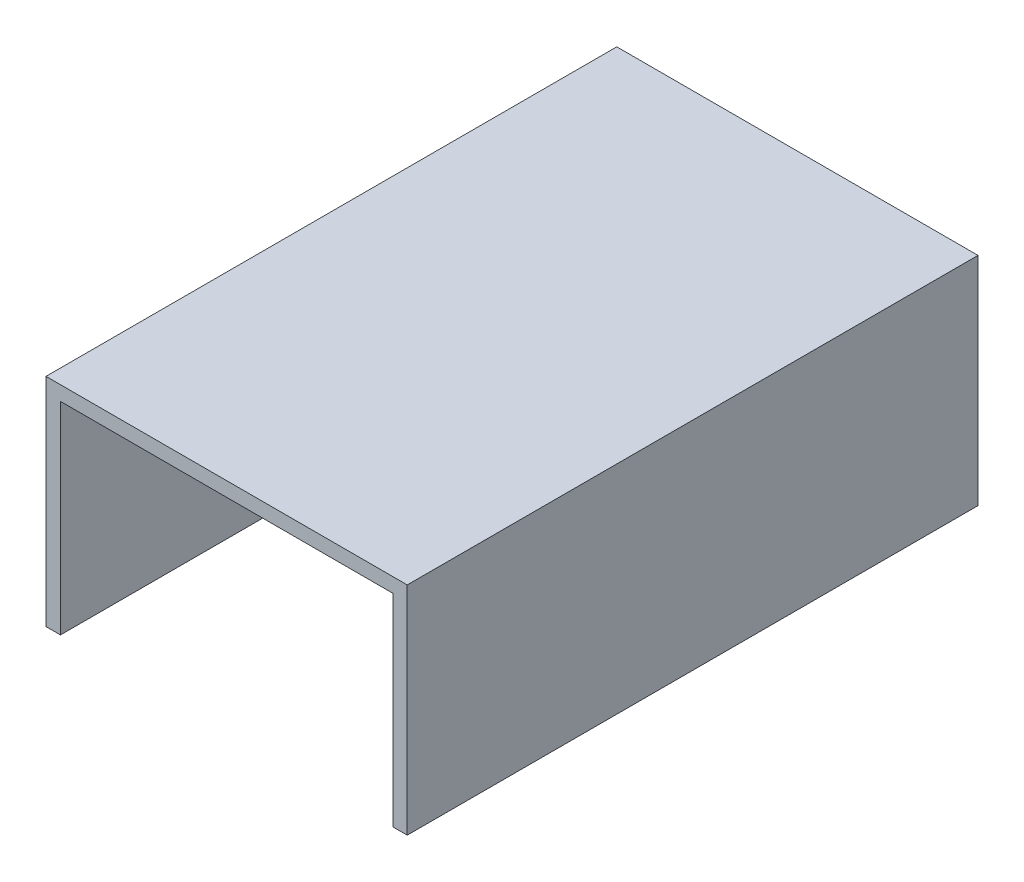
from build123d import *

# Parameters (mm, degrees)
EXTRUDE_THIN1_DEPTH = 79


with BuildPart() as part:
    # Sketch1 → Extrude-Thin1 (new body)
    with BuildSketch(Plane.XY):
        Polygon((0, 0), (0, 28), (46, 28), (46, 0), (48, 0), (48, 30), (-2, 30), (-2, 0), align=None)
    extrude(amount=-EXTRUDE_THIN1_DEPTH)


solid = part.part
